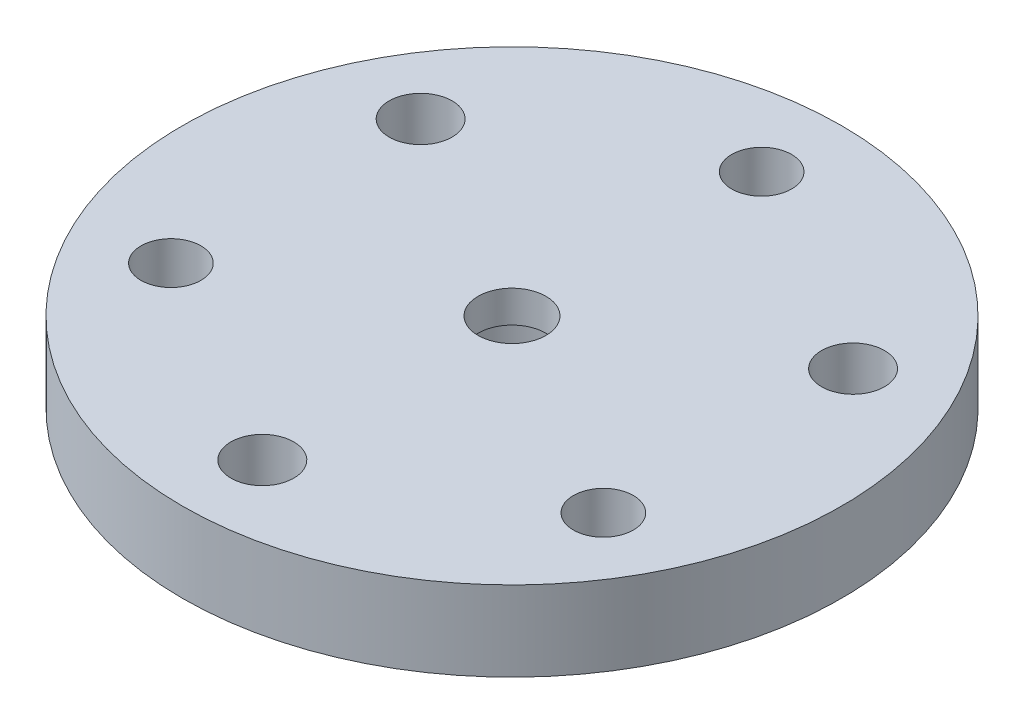
from build123d import *

# Parameters (mm, degrees)
SKETCH1_R                                            = 16.5
BOSS_EXTRUDE1_DEPTH                                  = 4
CBORE_FOR_M3_HEX_SOCKET_THIN_HEAD_CAP_SC_D           = 3.4
CBORE_FOR_M3_HEX_SOCKET_THIN_HEAD_CAP_SC_CBORE_D     = 6.5
CBORE_FOR_M3_HEX_SOCKET_THIN_HEAD_CAP_SC_CBORE_DEPTH = 2.4
F_3_0MM_DOWEL_HOLE1_D                                = 3
F_3_0MM_DOWEL_HOLE1_DEPTH                            = 6
F_3_0MM_DOWEL_HOLE1_TIP                              = 0.901290929
TAP_DRILL_FOR_M3_HELICOIL1_D                         = 3.15


with BuildPart() as part:
    # Sketch1 → Boss-Extrude1 (new body)
    with BuildSketch(Plane(origin=(0, 0, 0), x_dir=(1, 0, 0), z_dir=(0, 1, 0))):
        with Locations(Location((0, 0, 0), (0, 0, 270))):
            Circle(SKETCH1_R)
    extrude(amount=BOSS_EXTRUDE1_DEPTH)

    # CBORE for M3 Hex Socket Thin Head Cap Screw1 (through all)
    with Locations(Plane.XZ):
        with Locations((0, 0)):
            CounterBoreHole(CBORE_FOR_M3_HEX_SOCKET_THIN_HEAD_CAP_SC_D / 2, CBORE_FOR_M3_HEX_SOCKET_THIN_HEAD_CAP_SC_CBORE_D / 2, CBORE_FOR_M3_HEX_SOCKET_THIN_HEAD_CAP_SC_CBORE_DEPTH)

    # Ø3.0mm Dowel Hole1
    with Locations(Plane(origin=(0, 0, 0), x_dir=(-1, 0, 0), z_dir=(0, -1, 0))):
        with Locations((-10.825317547, -6.25), (0, 12.5), (10.825317547, -6.25)):
            Hole(F_3_0MM_DOWEL_HOLE1_D / 2, depth=F_3_0MM_DOWEL_HOLE1_DEPTH)
            with Locations((0, 0, -(F_3_0MM_DOWEL_HOLE1_DEPTH + F_3_0MM_DOWEL_HOLE1_TIP / 2))):  # 118° drill point
                Cone(0, F_3_0MM_DOWEL_HOLE1_D / 2, F_3_0MM_DOWEL_HOLE1_TIP, mode=Mode.SUBTRACT)

    # Tap Drill for M3 Helicoil1 (through all)
    with Locations(Plane(origin=(0, 0, 0), x_dir=(-1, 0, 0), z_dir=(0, -1, 0))):
        with Locations((10.825317547, 6.25), (0, -12.5), (-10.825317547, 6.25)):
            Hole(TAP_DRILL_FOR_M3_HELICOIL1_D / 2)


solid = part.part
